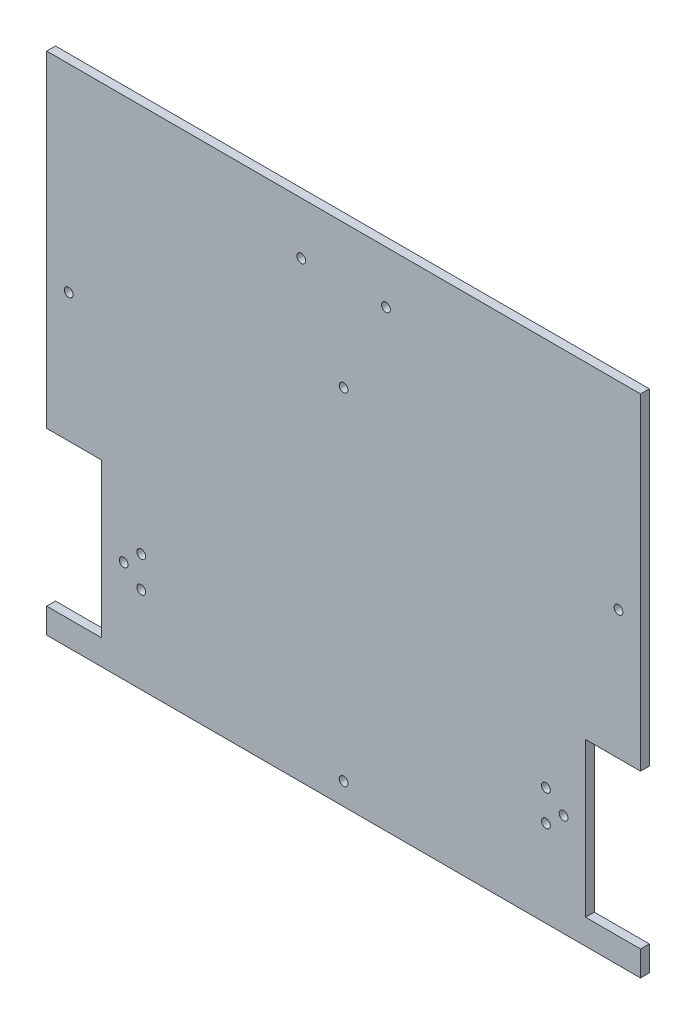
from build123d import *

# Parameters (mm, degrees)
SKETCH3_W           = 270
SKETCH3_H           = 230
BOSS_EXTRUDE1_DEPTH = 4
SKETCH4_W           = 25
SKETCH4_H           = 70
CUT_EXTRUDE1_DEPTH  = 10
SKETCH6_W           = 25
SKETCH6_H           = 70
CUT_EXTRUDE2_DEPTH  = 10
SKETCH9_R           = 2
CUT_EXTRUDE3_DEPTH  = 10
SKETCH10_R          = 2
CUT_EXTRUDE4_DEPTH  = 10
SKETCH12_R          = 2
CUT_EXTRUDE5_DEPTH  = 10
SKETCH14_R          = 2
CUT_EXTRUDE7_DEPTH  = 10
SKETCH15_R          = 2
CUT_EXTRUDE8_DEPTH  = 10


with BuildPart() as part:
    # Sketch3 → Boss-Extrude1 (new body)
    with BuildSketch(Plane.XY):
        with Locations((0, 115)):
            Rectangle(SKETCH3_W, SKETCH3_H)
    extrude(amount=BOSS_EXTRUDE1_DEPTH)

    # Sketch4 → Cut-Extrude1 (cut)
    with BuildSketch(Plane.XY.offset(4)):
        with Locations((-122.5, 46.430334796)):
            Rectangle(SKETCH4_W, SKETCH4_H)
    extrude(amount=-CUT_EXTRUDE1_DEPTH, mode=Mode.SUBTRACT)

    # Sketch6 → Cut-Extrude2 (cut)
    with BuildSketch(Plane.XY.offset(4)):
        with Locations((122.5, 46.430334796)):
            Rectangle(SKETCH6_W, SKETCH6_H)
    extrude(amount=-CUT_EXTRUDE2_DEPTH, mode=Mode.SUBTRACT)

    # Sketch9 → Cut-Extrude3 (cut)
    with BuildSketch(Plane(origin=(0, 0, 0), x_dir=(-1, 0, 0), z_dir=(0, 0, -1))):
        with Locations((-100, 46.430334796)):
            Circle(SKETCH9_R)
        with Locations((100, 46.186428088)):
            Circle(SKETCH9_R)
    extrude(amount=-CUT_EXTRUDE3_DEPTH, mode=Mode.SUBTRACT)

    # Sketch10 → Cut-Extrude4 (cut)
    with BuildSketch(Plane(origin=(0, 0, 0), x_dir=(-1, 0, 0), z_dir=(0, 0, -1))):
        with Locations((-19.25, 206.268311878)):
            Circle(SKETCH10_R)
        with Locations((19.25, 206.268311878)):
            Circle(SKETCH10_R)
    extrude(amount=-CUT_EXTRUDE4_DEPTH, mode=Mode.SUBTRACT)

    # Sketch12 → Cut-Extrude5 (cut)
    with BuildSketch(Plane.XY.offset(4)):
        with Locations((-125, 140)):
            Circle(SKETCH12_R)
        with Locations((125, 140)):
            Circle(SKETCH12_R)
        with Locations((0, 10)):
            Circle(SKETCH12_R)
    extrude(amount=-CUT_EXTRUDE5_DEPTH, mode=Mode.SUBTRACT)

    # Sketch14 → Cut-Extrude7 (cut)
    with BuildSketch(Plane.XY.offset(4)):
        with Locations((0, 165)):
            Circle(SKETCH14_R)
    extrude(amount=-CUT_EXTRUDE7_DEPTH, mode=Mode.SUBTRACT)

    # Sketch15 → Cut-Extrude8 (cut)
    with BuildSketch(Plane.XY.offset(4)):
        with Locations((92, 53.430334796)):
            Circle(SKETCH15_R)
        with Locations((92, 39.430334796)):
            Circle(SKETCH15_R)
    cut_extrude8 = extrude(amount=-CUT_EXTRUDE8_DEPTH, mode=Mode.SUBTRACT)

    # Mirror1: Cut-Extrude8 across plane
    add(cut_extrude8.mirror(Plane(origin=(0, 0, 0), x_dir=(0, 0, 1), z_dir=(1, 0, 0))), mode=Mode.SUBTRACT)


solid = part.part
